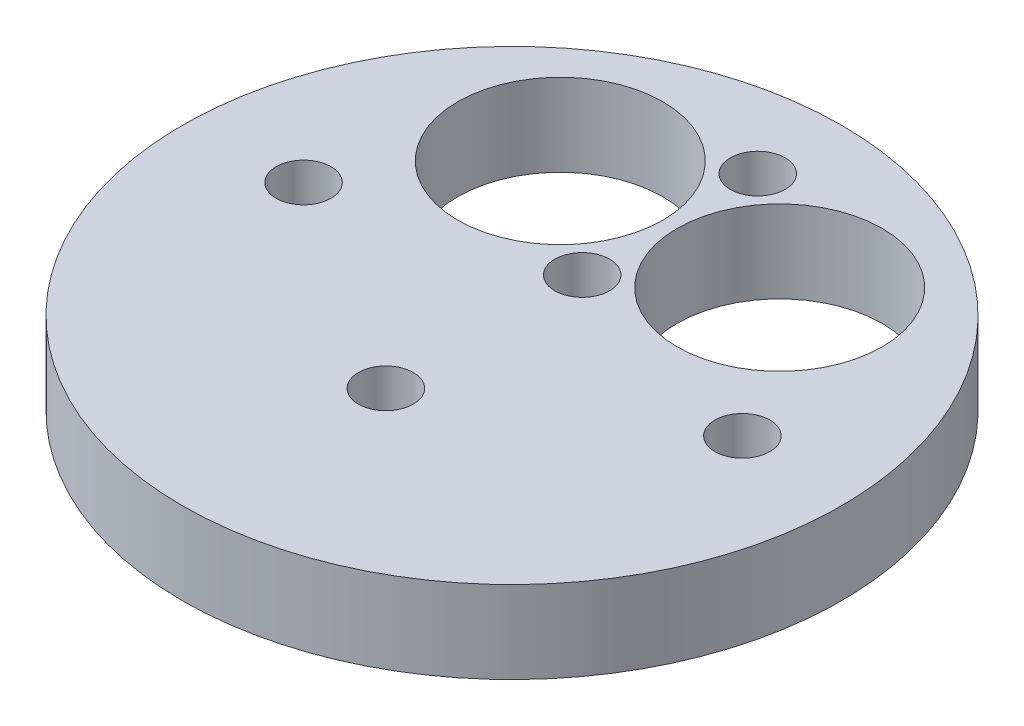
from build123d import *

# Parameters (mm, degrees)
SKETCH1_W               = 38.1508
SKETCH1_H               = 9.525
CUT_EXTRUDE1_DEPTH      = 55.787705795
CUT_EXTRUDE1_DEPTH_BACK = 55.787705795
SKETCH2_R               = 11.8745
SKETCH2_R_2             = 3.175
CUT_EXTRUDE2_DEPTH      = 55.787705795
CUT_EXTRUDE2_DEPTH_BACK = 55.787705795
SKETCH3_R               = 3.175


with BuildPart() as part:
    # Sketch1 → Revolve1 (revolve)
    with BuildSketch(Plane.XY):
        with Locations((19.0754, 4.7625)):
            Rectangle(SKETCH1_W, SKETCH1_H)
    revolve(axis=Axis((0, 0, 0), (0, 1, 0)))

    # Sketch2 → Cut-Extrude1 (cut, two sides: drawn at the far end of the back side and taken through both)
    with BuildSketch(Plane(origin=(0, 9.525, 0), x_dir=(1, 0, 0), z_dir=(0, 1, 0)).offset(-CUT_EXTRUDE1_DEPTH_BACK)):
        with Locations((-12.7, 18.288)):
            Circle(SKETCH2_R)
        with Locations((12.7, 18.288)):
            Circle(SKETCH2_R)
        with Locations((0, 28.448)):
            Circle(SKETCH2_R_2)
        with Locations((0, 8.128)):
            Circle(SKETCH2_R_2)
        with Locations((0, -14.605)):
            Circle(SKETCH2_R_2)
    extrude(amount=CUT_EXTRUDE1_DEPTH + CUT_EXTRUDE1_DEPTH_BACK, mode=Mode.SUBTRACT)

    # Sketch3 → Cut-Extrude2 (cut, two sides: drawn at the far end of the back side and taken through both)
    with BuildSketch(Plane(origin=(0, 9.525, 0), x_dir=(1, 0, 0), z_dir=(0, 1, 0)).offset(-CUT_EXTRUDE2_DEPTH_BACK)):
        with Locations((-25.4, 1.27)):
            Circle(SKETCH3_R)
        with Locations((25.4, 1.27)):
            Circle(SKETCH3_R)
    extrude(amount=CUT_EXTRUDE2_DEPTH + CUT_EXTRUDE2_DEPTH_BACK, mode=Mode.SUBTRACT)


solid = part.part
